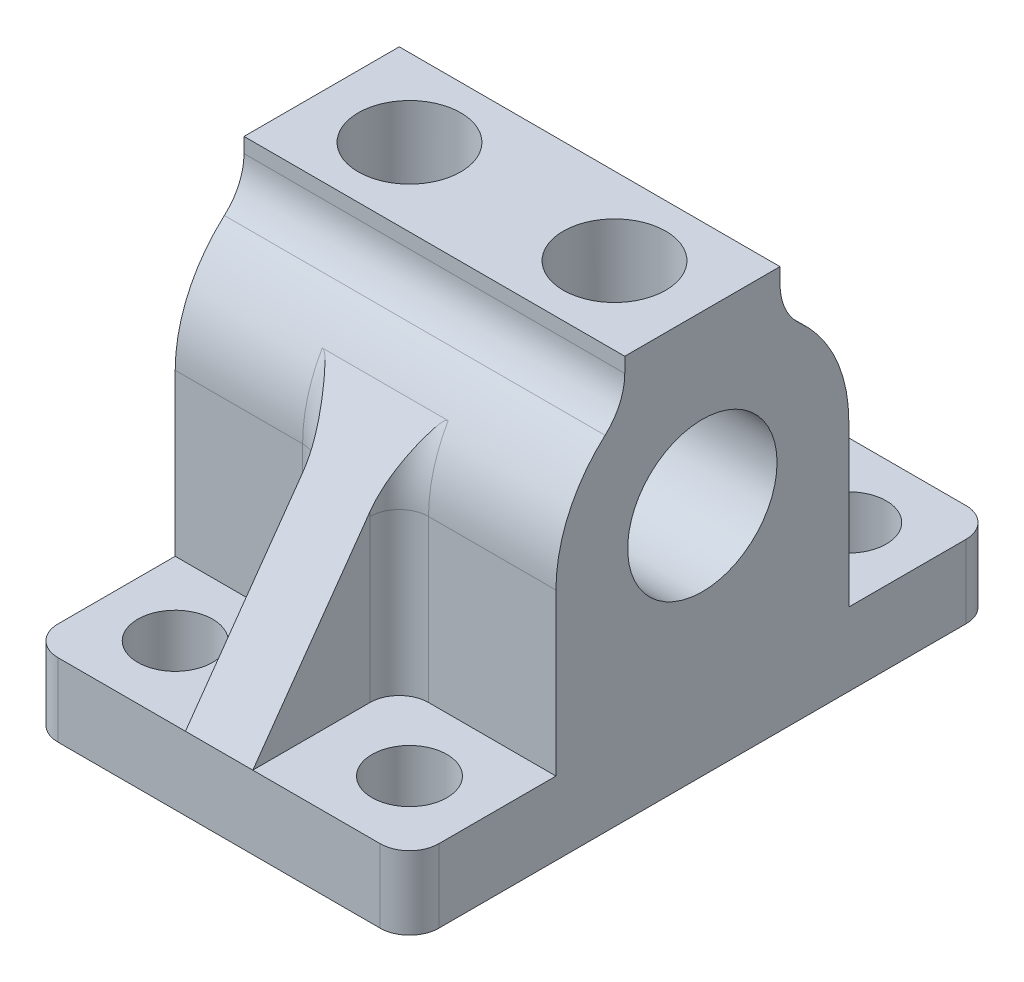
from build123d import *

# Parameters (mm, degrees)
SKETCH1_R           = 3.2385
BOSS_EXTRUDE1_DEPTH = 8.255
BOSS_EXTRUDE2_DEPTH = 1.4605
SKETCH3_R           = 1.6256
CUT_EXTRUDE1_DEPTH  = 21.180615699
CUT_EXTRUDE2_DEPTH  = 42.211451079
SKETCH6_W           = 16.51
SKETCH6_H           = 6.731
BOSS_EXTRUDE3_DEPTH = 1.905
SKETCH5_R           = 2.2225
CUT_EXTRUDE3_DEPTH  = 6.35
FILLET1_R           = 1.27
FILLET2_R           = 2.54


with BuildPart() as part:
    # Sketch1 → Boss-Extrude1 (new, symmetric)
    with BuildSketch(Plane(origin=(0, 0, 0), x_dir=(0, 0, -1), z_dir=(1, 0, 0))):
        with BuildLine():
            Line((12.7, 19.05), (-12.7, 19.05))
            Line((-12.7, 19.05), (-12.7, 22.225))
            Line((-12.7, 22.225), (-6.35, 22.225))
            Line((-6.35, 22.225), (-6.35, 29.21))
            ThreePointArc((-6.35, 29.21), (0, 35.56), (6.35, 29.21))
            Line((6.35, 29.21), (6.35, 22.225))
            Line((6.35, 22.225), (12.7, 22.225))
            Line((12.7, 22.225), (12.7, 19.05))
        make_face()
        with Locations((0, 29.21)):
            Circle(SKETCH1_R, mode=Mode.SUBTRACT)
    extrude(amount=BOSS_EXTRUDE1_DEPTH, both=True)

    # Sketch2 → Boss-Extrude2 (add, symmetric)
    with BuildSketch(Plane(origin=(0, 0, 0), x_dir=(0, 0, -1), z_dir=(1, 0, 0))):
        Polygon((-5.499261314, 32.385), (-12.7, 22.225), (-5.499261314, 22.225), align=None)
        Polygon((5.499261314, 22.225), (5.499261314, 32.385), (12.7, 22.225), align=None)
    extrude(amount=BOSS_EXTRUDE2_DEPTH, both=True)

    # Sketch3 → Cut-Extrude1 (cut, through all)
    with BuildSketch(Plane(origin=(0, 22.225, 0), x_dir=(1, 0, 0), z_dir=(0, 1, 0))):
        with Locations(Location((-5.08, 9.525, 0), (0, 0, 270))):
            Circle(SKETCH3_R)
        with Locations(Location((5.08, 9.525, 0), (0, 0, 90))):
            Circle(SKETCH3_R)
        with Locations(Location((5.08, -9.525, 0), (0, 0, 270))):
            Circle(SKETCH3_R)
        with Locations(Location((-5.08, -9.525, 0), (0, 0, 90))):
            Circle(SKETCH3_R)
    extrude(amount=-CUT_EXTRUDE1_DEPTH, mode=Mode.SUBTRACT)

    # Sketch4 → Cut-Extrude2 (cut, through all)
    with BuildSketch(Plane(origin=(8.255, 0, 0), x_dir=(0, 0, -1), z_dir=(1, 0, 0))):
        with BuildLine():
            Line((3.3655, 34.594785024), (-3.3655, 34.594785024))
            ThreePointArc((-3.3655, 34.594785024), (0, 35.56), (3.3655, 34.594785024))
        make_face()
    extrude(amount=-CUT_EXTRUDE2_DEPTH, mode=Mode.SUBTRACT)

    # Sketch6 → Boss-Extrude3 (add)
    with BuildSketch(Plane(origin=(0, 34.594785024, 0), x_dir=(1, 0, 0), z_dir=(0, 1, 0))):
        Rectangle(SKETCH6_W, SKETCH6_H)
    extrude(amount=BOSS_EXTRUDE3_DEPTH)

    # Sketch5 → Cut-Extrude3 (cut)
    with BuildSketch(Plane(origin=(0, 36.499785024, 0), x_dir=(1, 0, 0), z_dir=(0, 1, 0))):
        with Locations(Location((-4.445, 0, 0), (0, 0, 270))):
            Circle(SKETCH5_R)
        with Locations(Location((4.445, 0, 0), (0, 0, 270))):
            Circle(SKETCH5_R)
    extrude(amount=-CUT_EXTRUDE3_DEPTH, mode=Mode.SUBTRACT)

    # Fillet1
    fillet1_edges = [part.edges().sort_by_distance(p)[0] for p in [
        (-8.255, 20.6375, -12.7),
        (-8.255, 20.6375, 12.7),
        (8.255, 20.6375, -12.7),
        (1.4605, 25.7175, 6.35),
        (1.4605, 30.853500936, 6.133628997),
        (-1.4605, 25.7175, 6.35),
        (-1.4605, 30.853500936, 6.133628997),
        (-1.4605, 25.7175, -6.35),
        (1.4605, 25.7175, -6.35),
        (8.255, 20.6375, 12.7),
        (1.4605, 30.853500936, -6.133628997),
        (-1.4605, 30.853500936, -6.133628997),
    ]]
    fillet(fillet1_edges, radius=FILLET1_R)

    # Fillet2
    fillet2_edges = [part.edges().sort_by_distance(p)[0] for p in [
        (0, 34.594785024, 3.3655),
        (0, 34.594785024, -3.3655),
    ]]
    fillet(fillet2_edges, radius=FILLET2_R)


solid = part.part
